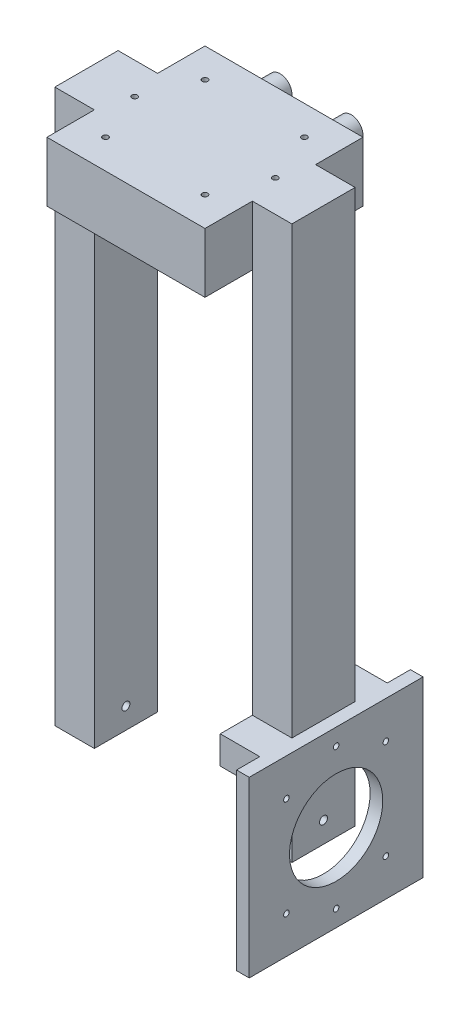
from build123d import *

# Parameters (mm, degrees)
SKETCH_1_W          = 150
SKETCH_1_H          = 40
EXTRUDE_1_DEPTH     = 350
CUT_EXTRUDE_3_REACH = 362.174
SKETCH_7_W          = 50
SKETCH_7_H          = 312.232580329
CUT_EXTRUDE_4_REACH = 383.314
SKETCH_8_R          = 2.5
EXTRUDE_START       = -20
SKETCH_12_W         = 100
SKETCH_12_H         = 37.767419671
EXTRUDE_2_DEPTH     = 50
SKETCH_14_R         = 1.75
CUT_EXTRUDE_7_DEPTH = 25
SKETCH_16_R         = 7.5
EXTRUDE_3_DEPTH     = 20
SKETCH_18_W         = 110
SKETCH_18_H         = 110
EXTRUDE_4_DEPTH     = 8
SKETCH_19_R         = 1.75
CUT_EXTRUDE_8_DEPTH = 8
SKETCH_20_R         = 29.5
CUT_EXTRUDE_9_DEPTH = 8
SKETCH_21_W         = 20.347444736
SKETCH_21_H         = 17.71885043
EXTRUDE_5_DEPTH     = 25


with BuildPart() as part:
    # 草图1 → 凸台-拉伸1 (new body)
    with BuildSketch(Plane(origin=(0, 0, 0), x_dir=(1, 0, 0), z_dir=(0, 1, 0))):
        Rectangle(SKETCH_1_W, SKETCH_1_H)
    extrude(amount=EXTRUDE_1_DEPTH)

    # 草图7 → 切除-拉伸3 (cut, up to next)
    with BuildSketch(Plane(origin=(0, 0, -20), x_dir=(-1, 0, 0), z_dir=(0, 0, -1)), mode=Mode.PRIVATE) as cut_extrude_3_sk1:
        with Locations((-25, 156.116290165)):
            Rectangle(SKETCH_7_W, SKETCH_7_H)
    cut_extrude_3_tool1 = extrude(cut_extrude_3_sk1.sketch, amount=-CUT_EXTRUDE_3_REACH, mode=Mode.PRIVATE) & part.part
    cut_extrude_3 = cut_extrude_3_tool1.solids().sort_by_distance((25, 156.11629, -20))[0]
    add(cut_extrude_3, mode=Mode.SUBTRACT)

    # 镜向2: 切除-拉伸3 across plane
    add(cut_extrude_3.mirror(Plane(origin=(0, 0, 0), x_dir=(0, 0, 1), z_dir=(1, 0, 0))), mode=Mode.SUBTRACT)

    # 草图8 → 切除-拉伸4 (cut, up to next)
    with BuildSketch(Plane.ZY.offset(75), mode=Mode.PRIVATE) as cut_extrude_4_sk1:
        with Locations((0, 13.236112216)):
            Circle(SKETCH_8_R)
    cut_extrude_4_tool1 = extrude(cut_extrude_4_sk1.sketch, amount=-CUT_EXTRUDE_4_REACH, mode=Mode.PRIVATE) & part.part
    cut_extrude_4 = cut_extrude_4_tool1.solids().sort_by_distance((-75, 13.236112, 0))[0]
    add(cut_extrude_4, mode=Mode.SUBTRACT)

    # 镜向3: 切除-拉伸4 across plane
    add(cut_extrude_4.mirror(Plane(origin=(0, 0, 0), x_dir=(0, 0, 1), z_dir=(1, 0, 0))), mode=Mode.SUBTRACT)

    # 草图12 → 凸台-拉伸2 (add, symmetric)
    with BuildSketch(Plane.XY.offset(20).offset(EXTRUDE_START)):
        with Locations((0, 331.116290165)):
            Rectangle(SKETCH_12_W, SKETCH_12_H)
    extrude(amount=EXTRUDE_2_DEPTH, both=True)

    # 草图14 → 切除-拉伸7 (cut)
    with BuildSketch(Plane(origin=(0, 350, 0), x_dir=(1, 0, 0), z_dir=(0, 1, 0))):
        with Locations(Location((-31.466251763, -31.466251763, 0), (0, 0, 270))):
            Circle(SKETCH_14_R)
        with Locations(Location((-44.5, 0, 0), (0, 0, 270))):
            Circle(SKETCH_14_R)
        with Locations(Location((-31.466251763, 31.466251763, 0), (0, 0, 270))):
            Circle(SKETCH_14_R)
        with Locations(Location((31.466251763, 31.466251763, 0), (0, 0, 270))):
            Circle(SKETCH_14_R)
        with Locations(Location((44.5, 0, 0), (0, 0, 270))):
            Circle(SKETCH_14_R)
        with Locations(Location((31.466251763, -31.466251763, 0), (0, 0, 270))):
            Circle(SKETCH_14_R)
    extrude(amount=-CUT_EXTRUDE_7_DEPTH, mode=Mode.SUBTRACT)

    # 草图16 → 凸台-拉伸3 (add)
    with BuildSketch(Plane(origin=(0, 0, -50), x_dir=(-1, 0, 0), z_dir=(0, 0, -1))):
        with Locations(Location((-22.5, 331.116290164, 0), (0, 0, 180))):
            Circle(SKETCH_16_R)
        with Locations(Location((22.5, 331.116290164, 0), (0, 0, 180))):
            Circle(SKETCH_16_R)
    extrude(amount=EXTRUDE_3_DEPTH)

    # 草图18 → 凸台-拉伸4 (add)
    with BuildSketch(Plane(origin=(75, 0, 0), x_dir=(0, 0, -1), z_dir=(1, 0, 0))):
        with Locations((0, 13.236112216)):
            Rectangle(SKETCH_18_W, SKETCH_18_H)
    extrude(amount=EXTRUDE_4_DEPTH)

    # 草图19 → 切除-拉伸8 (cut)
    with BuildSketch(Plane(origin=(83, 0, 0), x_dir=(0, 0, -1), z_dir=(1, 0, 0))):
        with Locations((0, -31.263887784)):
            Circle(SKETCH_19_R)
        with Locations((-31.466251763, -18.230139547)):
            Circle(SKETCH_19_R)
        with Locations((-31.466251763, 44.702363979)):
            Circle(SKETCH_19_R)
        with Locations((0, 57.736112216)):
            Circle(SKETCH_19_R)
        with Locations((31.466251763, 44.702363979)):
            Circle(SKETCH_19_R)
        with Locations((31.466251763, -18.230139547)):
            Circle(SKETCH_19_R)
    extrude(amount=-CUT_EXTRUDE_8_DEPTH, mode=Mode.SUBTRACT)

    # 草图20 → 切除-拉伸9 (cut)
    with BuildSketch(Plane(origin=(83, 0, 0), x_dir=(0, 0, -1), z_dir=(1, 0, 0))):
        with Locations((0, 13.236112216)):
            Circle(SKETCH_20_R)
    extrude(amount=-CUT_EXTRUDE_9_DEPTH, mode=Mode.SUBTRACT)

    # 草图21 → 凸台-拉伸5 (add)
    with BuildSketch(Plane.ZY.offset(-75)):
        with Locations((-30.173722368, 59.376687001)):
            Rectangle(SKETCH_21_W, SKETCH_21_H)
    extrude_5 = extrude(amount=EXTRUDE_5_DEPTH)

    # 镜向4: 凸台-拉伸5 across plane
    add(extrude_5.mirror(Plane.XY))


solid = part.part
